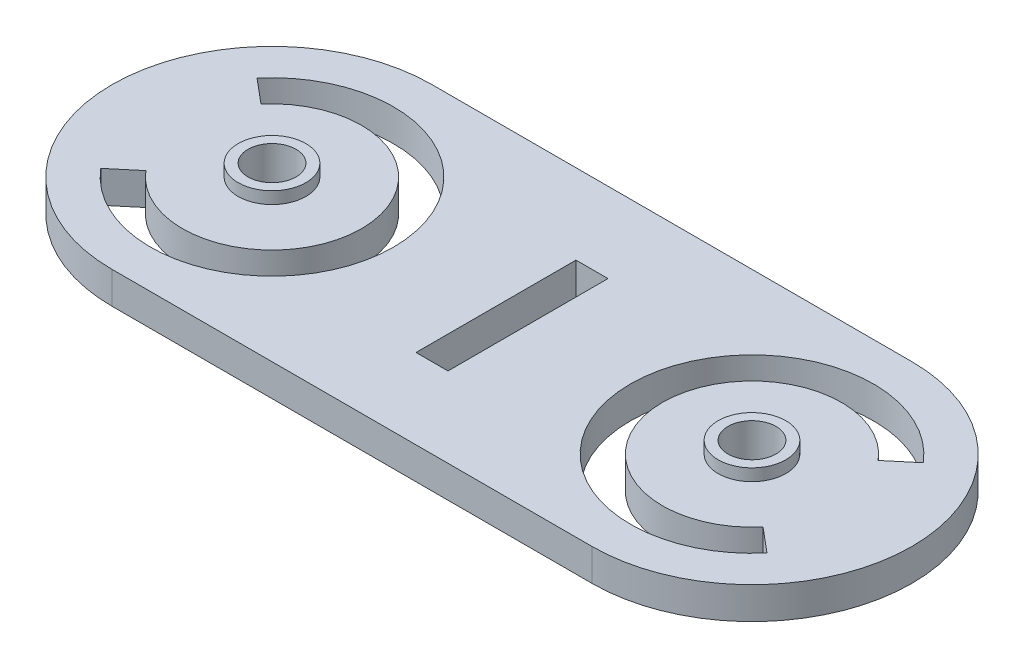
from build123d import *

# Parameters (mm, degrees)
BOSS_EXTRUDE1_DEPTH = 4.000000128
SKETCH2_R           = 2.999994
SKETCH2_W           = 3.999992
SKETCH2_H           = 20.0000108
CUT_EXTRUDE1_DEPTH  = 54.999999958
BOSS_EXTRUDE2_START = 1.499997
SKETCH3_R           = 4.2333418
SKETCH3_R_2         = 2.999994
BOSS_EXTRUDE2_DEPTH = 1.499997


with BuildPart() as part:
    # Sketch1 → Boss-Extrude1 (new body)
    with BuildSketch(Plane(origin=(0, 0, 0), x_dir=(1, 0, 0), z_dir=(0, 1, 0))):
        with BuildLine():
            Line((-29.999999944, 20), (29.999999944, 20))
            ThreePointArc((29.999999944, 20), (49.999999944, 0), (29.999999944, -20))
            Line((29.999999944, -20), (-29.999999944, -20))
            ThreePointArc((-29.999999944, -20), (-49.999999944, 0), (-29.999999944, 20))
        make_face()
    extrude(amount=BOSS_EXTRUDE1_DEPTH)

    # Sketch2 → Cut-Extrude1 (cut, through all)
    with BuildSketch(Plane(origin=(0, 4.000000128, 0), x_dir=(1, 0, 0), z_dir=(0, 1, 0))):
        with Locations(Location((-29.999999944, 0, 0), (0, 0, 270))):
            Circle(SKETCH2_R)
        with Locations(Location((29.999999944, 0, 0), (0, 0, 90))):
            Circle(SKETCH2_R)
        Rectangle(SKETCH2_W, SKETCH2_H)
        with BuildLine():
            Line((-41.640032544, 9.7671636), (-38.575878144, 7.1959978))
            ThreePointArc((-38.575878144, 7.1959978), (-18.804997879, 0), (-38.575878144, -7.1959978))
            Line((-38.575878144, -7.1959978), (-41.640032544, -9.7671636))
            ThreePointArc((-41.640032544, -9.7671636), (-14.805005909, 0), (-41.640032544, 9.7671636))
        make_face()
        with BuildLine():
            Line((41.640032544, -9.7671636), (38.575878144, -7.1959978))
            ThreePointArc((38.575878144, -7.1959978), (18.804997879, 0), (38.575878144, 7.1959978))
            Line((38.575878144, 7.1959978), (41.640032544, 9.7671636))
            ThreePointArc((41.640032544, 9.7671636), (14.805005909, 0), (41.640032544, -9.7671636))
        make_face()
    extrude(amount=-CUT_EXTRUDE1_DEPTH, mode=Mode.SUBTRACT)

    # Sketch3 → Boss-Extrude2 (add)
    # profile 1 of 2: a face of its own
    with BuildSketch(Plane(origin=(0, 4.000000128, 0), x_dir=(1, 0, 0), z_dir=(0, 1, 0)).offset(BOSS_EXTRUDE2_START)):
        with Locations(Location((-29.999999944, 0, 0), (0, 0, 270))):
            Circle(SKETCH3_R)
        with Locations(Location((-29.999999944, 0, 0), (0, 0, 270))):
            Circle(SKETCH3_R_2, mode=Mode.SUBTRACT)
    # profile 2 of 2: a face of its own
    with BuildSketch(Plane(origin=(0, 4.000000128, 0), x_dir=(1, 0, 0), z_dir=(0, 1, 0)).offset(BOSS_EXTRUDE2_START)):
        with Locations(Location((29.999999944, 0, 0), (0, 0, 90))):
            Circle(SKETCH3_R)
        with Locations(Location((29.999999944, 0, 0), (0, 0, 90))):
            Circle(SKETCH3_R_2, mode=Mode.SUBTRACT)
    extrude(amount=-BOSS_EXTRUDE2_DEPTH)


solid = part.part
